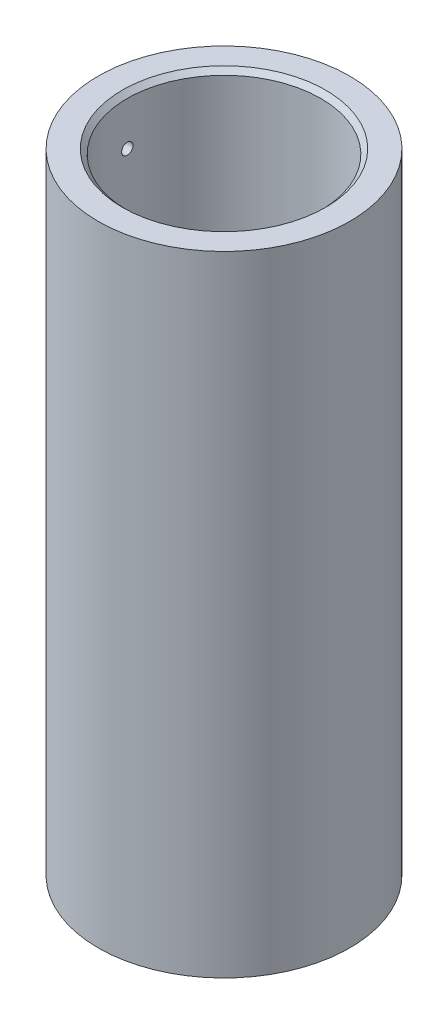
from build123d import *

# Parameters (mm, degrees)
SKETCH1_R           = 13
SKETCH1_R_2         = 10
BOSS_EXTRUDE1_DEPTH = 65
CHAMFER1_SIZE       = 0.5


with BuildPart() as part:
    # Sketch1 → Boss-Extrude1 (new body)
    with BuildSketch(Plane(origin=(0, 0, 0), x_dir=(1, 0, 0), z_dir=(0, 1, 0))):
        with Locations(Location((0, 0, 0), (0, 0, 270))):
            Circle(SKETCH1_R)
        with Locations(Location((0, 0, 0), (0, 0, 270))):
            Circle(SKETCH1_R_2, mode=Mode.SUBTRACT)
    extrude(amount=BOSS_EXTRUDE1_DEPTH)

    # Chamfer1
    chamfer1_edges = [part.edges().sort_by_distance(p)[0] for p in [
        (0, 0, -10),
        (0, 65, -10),
    ]]
    chamfer(chamfer1_edges, length=CHAMFER1_SIZE)

    # Sketch5 → Cut-Revolve4 (revolve, cut)
    with BuildSketch(Plane.XY, mode=Mode.PRIVATE) as cut_revolve4_sk:
        Polygon((-13, 60.948970234), (-12, 60.585), (-9, 60.585), (-9, 60), (-13, 60), align=None)
    revolve(cut_revolve4_sk.sketch.rotate(Axis((-13, 60, 0), (1, 0, 0)), 90), axis=Axis((-13, 60, 0), (1, 0, 0)), mode=Mode.SUBTRACT)


solid = part.part
